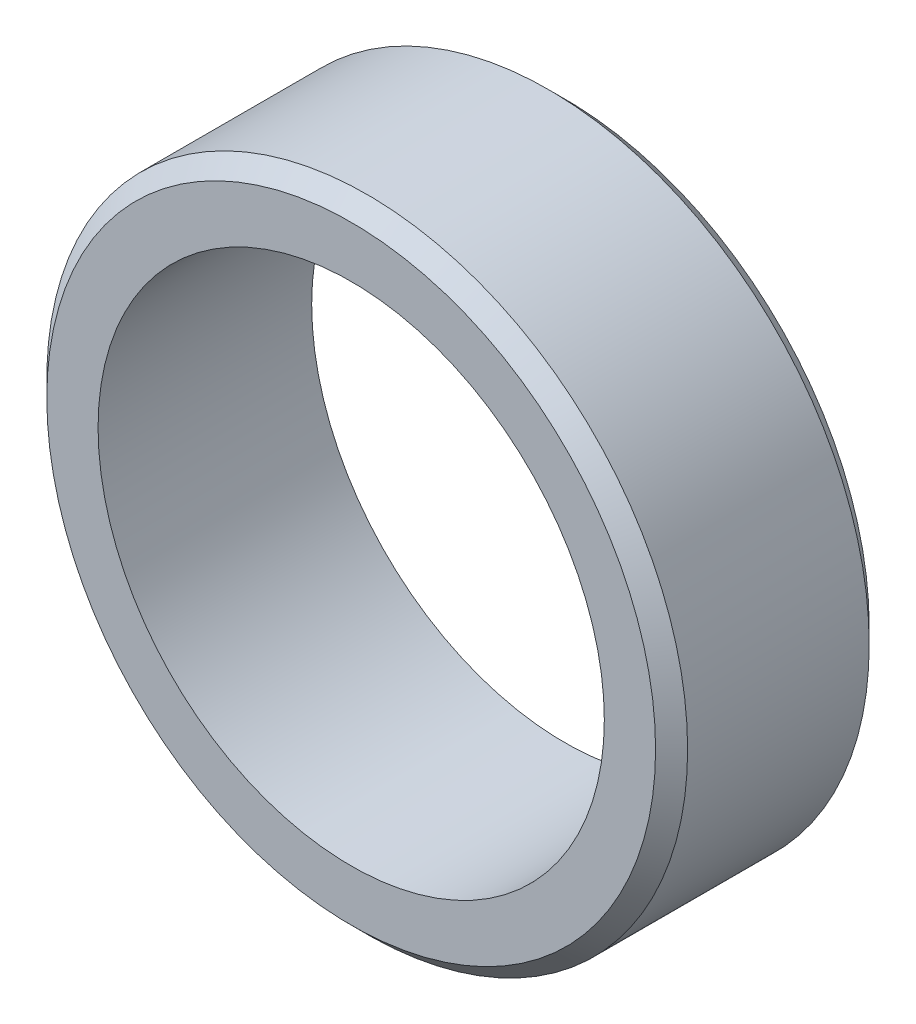
from build123d import *

# Parameters (mm, degrees)
BOSS_EXTRUDE1_DEPTH      = 7.9375
BOSS_EXTRUDE1_DEPTH_BACK = 7.9375
SKETCH3_R                = 19.05
SKETCH3_R_2              = 9.525
CHAMFER1_SIZE            = 0.9525
SKETCH4_R                = 19.05
CUT_EXTRUDE1_DEPTH       = 3.175
SKETCH5_R                = 15.0495
CUT_EXTRUDE2_DEPTH       = 30.784140075
CHAMFER2_SIZE            = 0.9525


with BuildPart() as part:
    # Sketch3 → Boss-Extrude1 (new, two sides: drawn at the far end of the back side and taken through both)
    with BuildSketch(Plane.XY.offset(-BOSS_EXTRUDE1_DEPTH_BACK)):
        Circle(SKETCH3_R)
        Circle(SKETCH3_R_2, mode=Mode.SUBTRACT)
    extrude(amount=BOSS_EXTRUDE1_DEPTH + BOSS_EXTRUDE1_DEPTH_BACK)

    # Chamfer1
    chamfer1_edges = [part.edges().sort_by_distance(p)[0] for p in [
        (-19.05, 0, -7.9375),
        (-9.525, 0, -7.9375),
        (-19.05, 0, 7.9375),
        (-9.525, 0, 7.9375),
    ]]
    chamfer(chamfer1_edges, length=CHAMFER1_SIZE)

    # Sketch4 → Cut-Extrude1 (cut)
    with BuildSketch(Plane.XY.offset(7.9375)):
        Circle(SKETCH4_R)
    extrude(amount=-CUT_EXTRUDE1_DEPTH, mode=Mode.SUBTRACT)

    # Sketch5 → Cut-Extrude2 (cut, through all)
    with BuildSketch(Plane.XY.offset(4.7625)):
        Circle(SKETCH5_R)
    extrude(amount=-CUT_EXTRUDE2_DEPTH, mode=Mode.SUBTRACT)

    # Chamfer2
    chamfer2_edges = [part.edges().sort_by_distance(p)[0] for p in [
        (-19.05, 0, 4.7625),
    ]]
    chamfer(chamfer2_edges, length=CHAMFER2_SIZE)


solid = part.part
